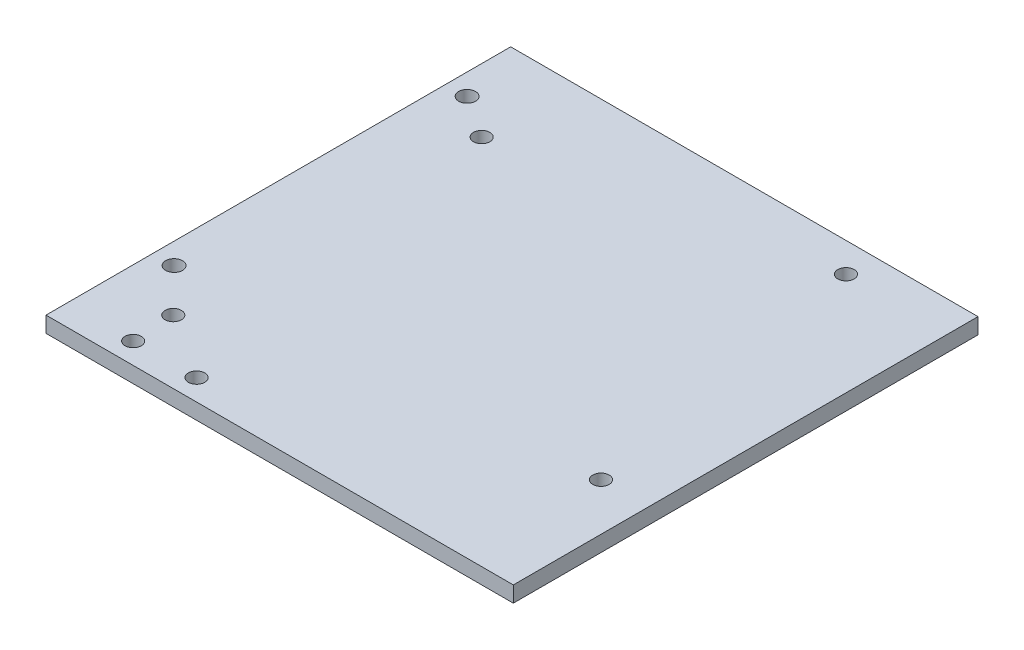
from build123d import *

# Parameters (mm, degrees)
SKETCH1_R           = 1.55
SKETCH1_R_2         = 1.6
BOSS_EXTRUDE1_DEPTH = 3


with BuildPart() as part:
    # Sketch1 → Boss-Extrude1 (new body)
    with BuildSketch(Plane(origin=(0, 0, 0), x_dir=(1, 0, 0), z_dir=(0, 1, 0))):
        Polygon((-40.25, 40), (40.25, 40), (40.25, -40), (40.25, -48), (-48.25, -48), (-48.25, -40), (-48.25, 40), align=None)
        with Locations(Location((-36.2, -35.95, 0), (0, 0, 270))):
            Circle(SKETCH1_R, mode=Mode.SUBTRACT)
        with Locations(Location((-36.2, 22.45, 0), (0, 0, 270))):
            Circle(SKETCH1_R, mode=Mode.SUBTRACT)
        with Locations(Location((20.8, 34.45, 0), (0, 0, 270))):
            Circle(SKETCH1_R, mode=Mode.SUBTRACT)
        with Locations(Location((31.3, -22.45, 0), (0, 0, 270))):
            Circle(SKETCH1_R, mode=Mode.SUBTRACT)
        with Locations(Location((-44.25, 27.75, 0), (0, 0, 270))):
            Circle(SKETCH1_R_2, mode=Mode.SUBTRACT)
        with Locations(Location((-44.25, -27.75, 0), (0, 0, 270))):
            Circle(SKETCH1_R_2, mode=Mode.SUBTRACT)
        with Locations(Location((-35.74, -44, 0), (0, 0, 270))):
            Circle(SKETCH1_R, mode=Mode.SUBTRACT)
        with Locations(Location((-23.74, -44, 0), (0, 0, 270))):
            Circle(SKETCH1_R, mode=Mode.SUBTRACT)
    extrude(amount=BOSS_EXTRUDE1_DEPTH)


solid = part.part
